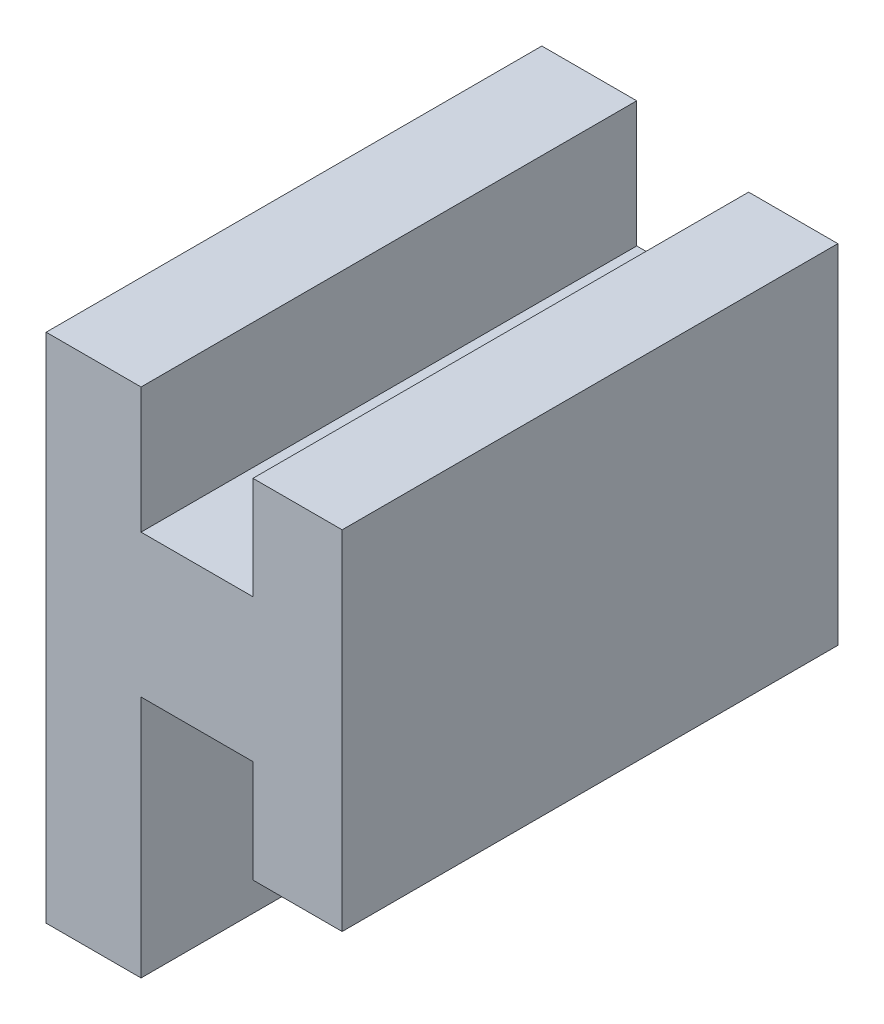
from build123d import *

# Parameters (mm, degrees)
BOSS_EXTRUDE1_DEPTH = 10


with BuildPart() as part:
    # Sketch2 → Boss-Extrude1 (new body)
    with BuildSketch(Plane.XY):
        Polygon((-32.1, -9.633023841), (-32.1, -12.169217722), (-29.842797906, -12.169217722), (-29.842797906, -10.1), (-28.042797906, -10.1), (-28.042797906, -17.118869174), (-29.842797906, -17.118869174), (-29.842797906, -15.049651452), (-32.1, -15.049651452), (-32.1, -19.958982177), (-34.014430759, -19.958982177), (-34.014430759, -9.633023841), align=None)
    extrude(amount=-BOSS_EXTRUDE1_DEPTH)


solid = part.part
